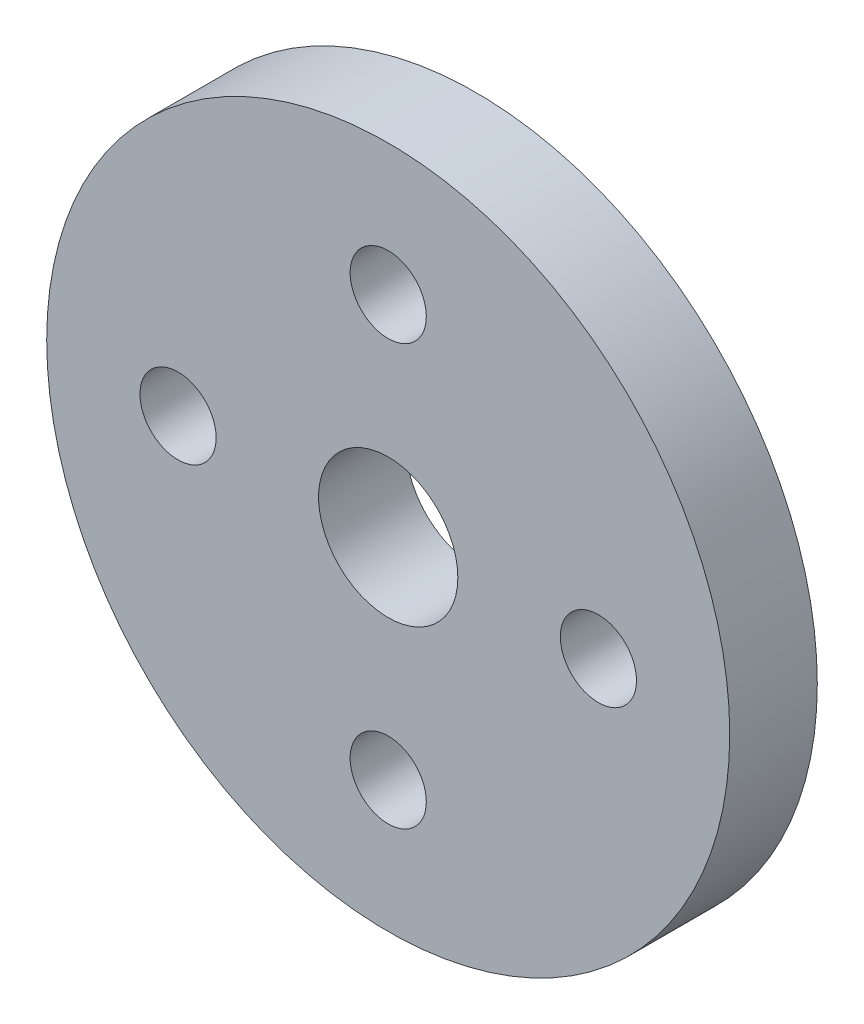
from build123d import *

# Parameters (mm, degrees)
SKETCH1_R           = 19.5
SKETCH1_R_2         = 2.175
SKETCH1_R_3         = 3.975
BOSS_EXTRUDE1_DEPTH = 5


with BuildPart() as part:
    # Sketch1 → Boss-Extrude1 (new body)
    with BuildSketch(Plane.XY):
        Circle(SKETCH1_R)
        with Locations((12, 0)):
            Circle(SKETCH1_R_2, mode=Mode.SUBTRACT)
        with Locations((0, 12)):
            Circle(SKETCH1_R_2, mode=Mode.SUBTRACT)
        with Locations((-12, 0)):
            Circle(SKETCH1_R_2, mode=Mode.SUBTRACT)
        with Locations((0, -12)):
            Circle(SKETCH1_R_2, mode=Mode.SUBTRACT)
        Circle(SKETCH1_R_3, mode=Mode.SUBTRACT)
    extrude(amount=BOSS_EXTRUDE1_DEPTH)


solid = part.part
